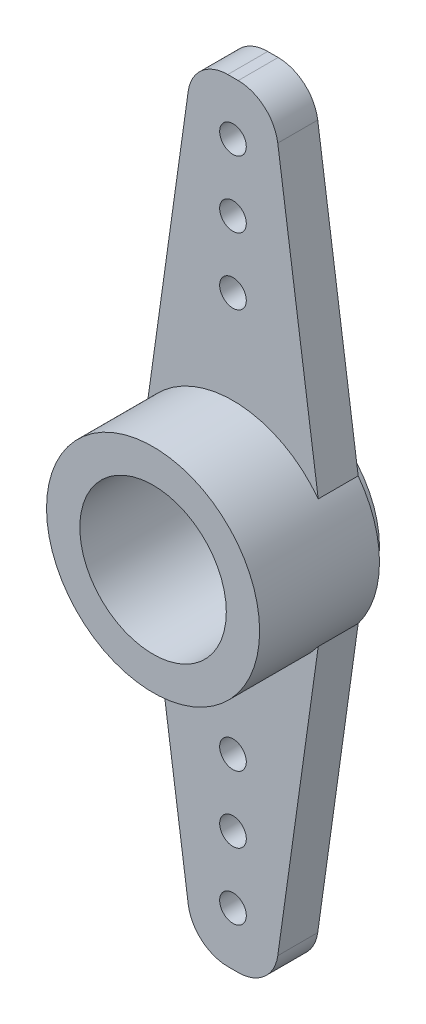
from build123d import *
from build123d.topology import SkipClean

# Parameters (mm, degrees)
SKETCH1_R           = 0.5
SKETCH1_R_2         = 1.5
BOSS_EXTRUDE3_DEPTH = 1.5
SKETCH2_R           = 4
BOSS_EXTRUDE4_DEPTH = 3
SKETCH3_R           = 3.5
SKETCH3_R_2         = 3.25
BOSS_EXTRUDE5_DEPTH = 0.5
SKETCH4_R           = 2.75
CUT_EXTRUDE1_DEPTH  = 4


with BuildPart() as part:
    # Sketch1 → Boss-Extrude3 (new body)
    with BuildSketch(Plane.XY):
        with BuildLine():
            Line((-3.2, 2.4), (-1.681423136, 13.208694151))
            ThreePointArc((-1.681423136, 13.208694151), (-1.180125332, 14.132042673), (-0.196011829, 14.5))
            Line((-0.196011829, 14.5), (0.196011829, 14.5))
            ThreePointArc((0.196011829, 14.5), (1.180125332, 14.132042673), (1.681423136, 13.208694151))
            Line((1.681423136, 13.208694151), (3.2, 2.4))
            ThreePointArc((3.2, 2.4), (4, 0), (3.2, -2.4))
            Line((3.2, -2.4), (1.681423136, -13.208694151))
            ThreePointArc((1.681423136, -13.208694151), (1.180125332, -14.132042673), (0.196011829, -14.5))
            Line((0.196011829, -14.5), (-0.196011829, -14.5))
            ThreePointArc((-0.196011829, -14.5), (-1.180125332, -14.132042673), (-1.681423136, -13.208694151))
            Line((-1.681423136, -13.208694151), (-3.2, -2.4))
            ThreePointArc((-3.2, -2.4), (-4, 0), (-3.2, 2.4))
        make_face()
        with Locations((0, 10)):
            Circle(SKETCH1_R, mode=Mode.SUBTRACT)
        with Locations((0, 12.5)):
            Circle(SKETCH1_R, mode=Mode.SUBTRACT)
        with Locations((0, 7.5)):
            Circle(SKETCH1_R, mode=Mode.SUBTRACT)
        Circle(SKETCH1_R_2, mode=Mode.SUBTRACT)
        with Locations(Location((0, -7.5, 0), (0, 0, 180))):
            Circle(SKETCH1_R, mode=Mode.SUBTRACT)
        with Locations(Location((0, -12.5, 0), (0, 0, 180))):
            Circle(SKETCH1_R, mode=Mode.SUBTRACT)
        with Locations(Location((0, -10, 0), (0, 0, 180))):
            Circle(SKETCH1_R, mode=Mode.SUBTRACT)
    extrude(amount=BOSS_EXTRUDE3_DEPTH)

    # Sketch2 → Boss-Extrude4 (add)
    with SkipClean():  # the faces are left unmerged after this step: merging them gives an invalid solid
        with BuildSketch(Plane.XY.offset(1.5)):
            with Locations(Location((0, 0, 0), (0, 0, 143.130102354))):
                Circle(SKETCH2_R)
        extrude(amount=BOSS_EXTRUDE4_DEPTH)

    # Sketch3 → Boss-Extrude5 (add)
    with SkipClean():  # the faces are left unmerged after this step: merging them gives an invalid solid
        with BuildSketch(Plane(origin=(0, 0, 0), x_dir=(-1, 0, 0), z_dir=(0, 0, -1))):
            with Locations(Location((0, 0, 0), (0, 0, 180))):
                Circle(SKETCH3_R)
            Circle(SKETCH3_R_2, mode=Mode.SUBTRACT)
        extrude(amount=BOSS_EXTRUDE5_DEPTH)

    # Sketch4 → Cut-Extrude1 (cut)
    with SkipClean():  # the faces are left unmerged after this step: merging them gives an invalid solid
        with BuildSketch(Plane.XY.offset(4.5)):
            Circle(SKETCH4_R)
        extrude(amount=-CUT_EXTRUDE1_DEPTH, mode=Mode.SUBTRACT)


solid = part.part
